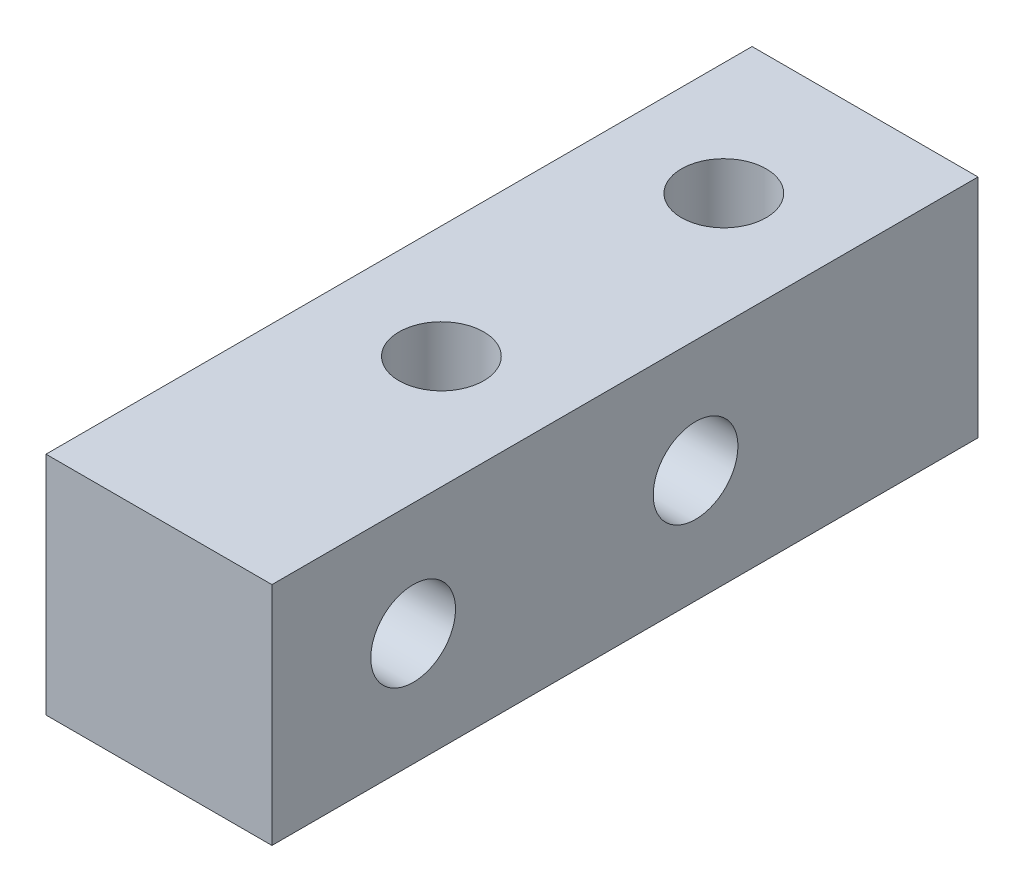
from build123d import *

# Parameters (mm, degrees)
SKETCH_1_W          = 8
SKETCH_1_H          = 8
EXTRUDE_1_DEPTH     = 25
SKETCH_2_R          = 1.5
CUT_EXTRUDE_1_DEPTH = 21
SKETCH_3_R          = 1.5
CUT_EXTRUDE_2_DEPTH = 21


with BuildPart() as part:
    # 草图1 → 凸台-拉伸1 (new body)
    with BuildSketch(Plane.XY):
        with Locations((4, 4)):
            Rectangle(SKETCH_1_W, SKETCH_1_H)
    extrude(amount=EXTRUDE_1_DEPTH)

    # 草图2 → 切除-拉伸1 (cut)
    with BuildSketch(Plane(origin=(0, 8, 0), x_dir=(1, 0, 0), z_dir=(0, 1, 0))):
        with Locations(Location((4, -5, 0), (0, 0, 270))):
            Circle(SKETCH_2_R)
        with Locations(Location((4, -15, 0), (0, 0, 270))):
            Circle(SKETCH_2_R)
    extrude(amount=-CUT_EXTRUDE_1_DEPTH, mode=Mode.SUBTRACT)

    # 草图3 → 切除-拉伸2 (cut)
    with BuildSketch(Plane(origin=(8, 0, 0), x_dir=(0, 0, -1), z_dir=(1, 0, 0))):
        with Locations((-20, 4)):
            Circle(SKETCH_3_R)
        with Locations((-10, 4)):
            Circle(SKETCH_3_R)
    extrude(amount=-CUT_EXTRUDE_2_DEPTH, mode=Mode.SUBTRACT)


solid = part.part
